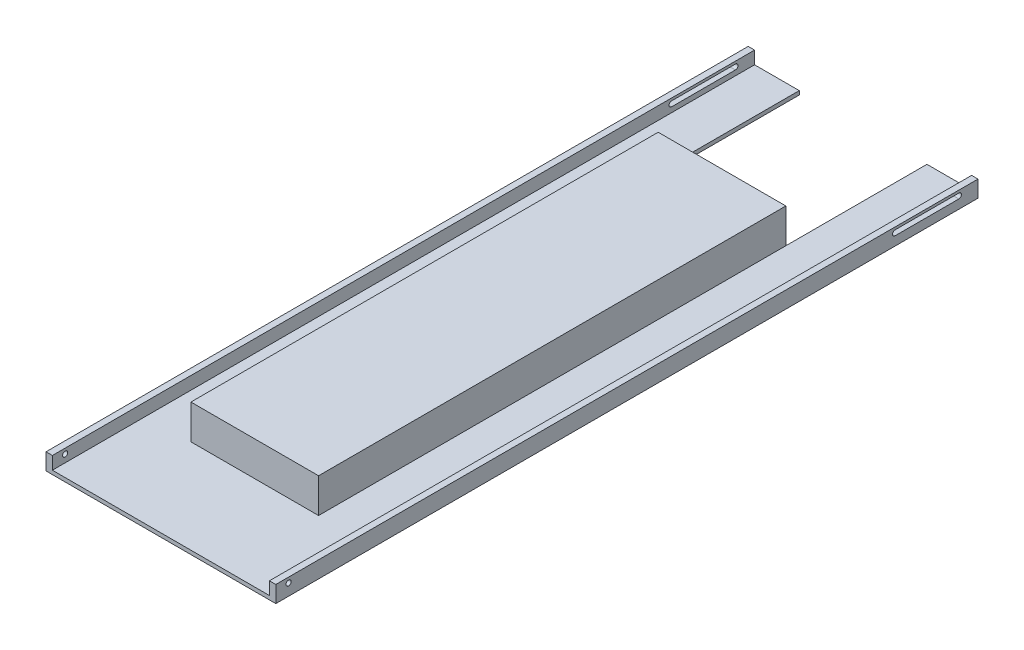
from build123d import *

# Parameters (mm, degrees)
BOSS_EXTRUDE1_DEPTH   = 550
F_4_0MM_DOWEL_HOLE1_D = 4
CUT_EXTRUDE1_DEPTH    = 579.75873098
SKETCH7_W             = 100
SKETCH7_H             = 409.5
CUT_EXTRUDE2_DEPTH    = 575.598945437
SKETCH8_W             = 100
SKETCH8_H             = 2
BOSS_EXTRUDE2_DEPTH   = 23
SKETCH9_W             = 100
SKETCH9_H             = 2
BOSS_EXTRUDE3_DEPTH   = 364
SKETCH10_W            = 100
SKETCH10_H            = 64.953820437
CUT_EXTRUDE3_DEPTH    = 364
SKETCH11_W            = 100
SKETCH11_H            = 35.696147614
CUT_EXTRUDE4_DEPTH    = 364
SKETCH12_W            = 5
SKETCH12_H            = 4
CUT_EXTRUDE6_DEPTH    = 575.781517842
SKETCH13_W            = 35
SKETCH13_H            = 2
CUT_EXTRUDE7_DEPTH    = 575.781517842
BOSS_EXTRUDE4_DEPTH   = 2
SKETCH15_W            = 35
SKETCH15_H            = 2
CUT_EXTRUDE8_DEPTH    = 575.781517842
SKETCH18_W            = 100
SKETCH18_H            = 7.149859065
CUT_EXTRUDE10_DEPTH   = 73.5
SKETCH22_W            = 2
SKETCH22_H            = 28
BOSS_EXTRUDE8_DEPTH   = 364
SKETCH24_W            = 2
SKETCH24_H            = 28
BOSS_EXTRUDE9_DEPTH   = 364


with BuildPart() as part:
    # Sketch1 → Boss-Extrude1 (new body)
    with BuildSketch(Plane.XY):
        Polygon((-165.647058824, 7.852941176), (-165.647058824, -7.147058824), (14.352941176, -7.147058824), (14.352941176, 7.852941176), (9.352941176, 7.852941176), (9.352941176, -2.147058824), (-160.647058824, -2.147058824), (-160.647058824, 7.852941176), align=None)
    extrude(amount=BOSS_EXTRUDE1_DEPTH)

    # Ø4.0mm Dowel Hole1 (through all)
    with Locations(Plane(origin=(14.352941176, 0, 0), x_dir=(0, 0, -1), z_dir=(1, 0, 0))):
        with Locations((-540, -0.147058824)):
            Hole(F_4_0MM_DOWEL_HOLE1_D / 2)

    # Sketch5 → Cut-Extrude1 (cut, through all)
    with BuildSketch(Plane(origin=(14.352941176, 0, 0), x_dir=(0, 0, -1), z_dir=(1, 0, 0))):
        with BuildLine():
            Line((-65, 1.852941176), (-15, 1.852941176))
            ThreePointArc((-15, 1.852941176), (-13, -0.147058824), (-15, -2.147058824))
            Line((-15, -2.147058824), (-65, -2.147058824))
            ThreePointArc((-65, -2.147058824), (-67, -0.147058824), (-65, 1.852941176))
        make_face()
    extrude(amount=-CUT_EXTRUDE1_DEPTH, mode=Mode.SUBTRACT)

    # Sketch7 → Cut-Extrude2 (cut, through all)
    with BuildSketch(Plane.XZ.offset(7.147058824)):
        with Locations((-75.647058824, 269.75)):
            Rectangle(SKETCH7_W, SKETCH7_H)
    extrude(amount=-CUT_EXTRUDE2_DEPTH, mode=Mode.SUBTRACT)

    # Sketch8 → Boss-Extrude2 (add)
    with BuildSketch(Plane(origin=(0, -2.147058824, 0), x_dir=(1, 0, 0), z_dir=(0, 1, 0))):
        with Locations((-75.647058824, -475.5)):
            Rectangle(SKETCH8_W, SKETCH8_H)
    extrude(amount=BOSS_EXTRUDE2_DEPTH)

    # Sketch9 → Boss-Extrude3 (add)
    with BuildSketch(Plane(origin=(0, 0, 474.5), x_dir=(-1, 0, 0), z_dir=(0, 0, -1))):
        with Locations((75.647058824, 19.852941176)):
            Rectangle(SKETCH9_W, SKETCH9_H)
    extrude(amount=BOSS_EXTRUDE3_DEPTH)

    # Sketch10 → Cut-Extrude3 (cut)
    with BuildSketch(Plane.XZ.offset(7.147058824)):
        with Locations((-75.647058824, 32.523089781)):
            Rectangle(SKETCH10_W, SKETCH10_H)
    extrude(amount=-CUT_EXTRUDE3_DEPTH, mode=Mode.SUBTRACT)

    # Sketch11 → Cut-Extrude4 (cut)
    with BuildSketch(Plane.XZ.offset(7.147058824)):
        with Locations((-75.647058824, -10.567416996)):
            Rectangle(SKETCH11_W, SKETCH11_H)
    extrude(amount=-CUT_EXTRUDE4_DEPTH, mode=Mode.SUBTRACT)

    # Sketch12 → Cut-Extrude6 (cut, through all)
    with BuildSketch(Plane(origin=(0, 0, 0), x_dir=(-1, 0, 0), z_dir=(0, 0, -1))):
        with Locations((-11.852941176, 5.852941176)):
            Rectangle(SKETCH12_W, SKETCH12_H)
        with Locations((163.147058824, 5.852941176)):
            Rectangle(SKETCH12_W, SKETCH12_H)
    extrude(amount=-CUT_EXTRUDE6_DEPTH, mode=Mode.SUBTRACT)

    # Sketch13 → Cut-Extrude7 (cut, through all)
    with BuildSketch(Plane(origin=(0, 0, 0), x_dir=(-1, 0, 0), z_dir=(0, 0, -1))):
        with Locations((8.147058824, -3.147058824)):
            Rectangle(SKETCH13_W, SKETCH13_H)
        with Locations((143.147058824, -3.147058824)):
            Rectangle(SKETCH13_W, SKETCH13_H)
    extrude(amount=-CUT_EXTRUDE7_DEPTH, mode=Mode.SUBTRACT)

    # Sketch14 → Boss-Extrude4 (add)
    with BuildSketch(Plane.XZ.offset(7.147058824)):
        Polygon((-165.647058824, 0), (-125.647058824, 0), (-125.647058824, 474.5), (-25.647058824, 474.5), (-25.647058824, 0), (14.352941176, 0), (14.352941176, 550), (-165.647058824, 550), align=None)
    extrude(amount=BOSS_EXTRUDE4_DEPTH)

    # Sketch15 → Cut-Extrude8 (cut, through all)
    with BuildSketch(Plane(origin=(0, 0, 0), x_dir=(-1, 0, 0), z_dir=(0, 0, -1))):
        with Locations((143.147058824, -5.147058824)):
            Rectangle(SKETCH15_W, SKETCH15_H)
        with Locations((8.147058824, -5.147058824)):
            Rectangle(SKETCH15_W, SKETCH15_H)
    extrude(amount=-CUT_EXTRUDE8_DEPTH, mode=Mode.SUBTRACT)

    # Sketch18 → Cut-Extrude10 (cut)
    with BuildSketch(Plane.XY.offset(550)):
        with Locations((-75.647058824, -2.572129292)):
            Rectangle(SKETCH18_W, SKETCH18_H)
    extrude(amount=-CUT_EXTRUDE10_DEPTH, mode=Mode.SUBTRACT)

    # Sketch22 → Boss-Extrude8 (add)
    with BuildSketch(Plane(origin=(0, 0, 474.5), x_dir=(-1, 0, 0), z_dir=(0, 0, -1))):
        with Locations((124.647058824, 4.852941176)):
            Rectangle(SKETCH22_W, SKETCH22_H)
    extrude(amount=BOSS_EXTRUDE8_DEPTH)

    # Sketch24 → Boss-Extrude9 (add)
    with BuildSketch(Plane(origin=(0, 0, 474.5), x_dir=(-1, 0, 0), z_dir=(0, 0, -1))):
        with Locations((26.647058824, 4.852941176)):
            Rectangle(SKETCH24_W, SKETCH24_H)
    extrude(amount=BOSS_EXTRUDE9_DEPTH)


solid = part.part
